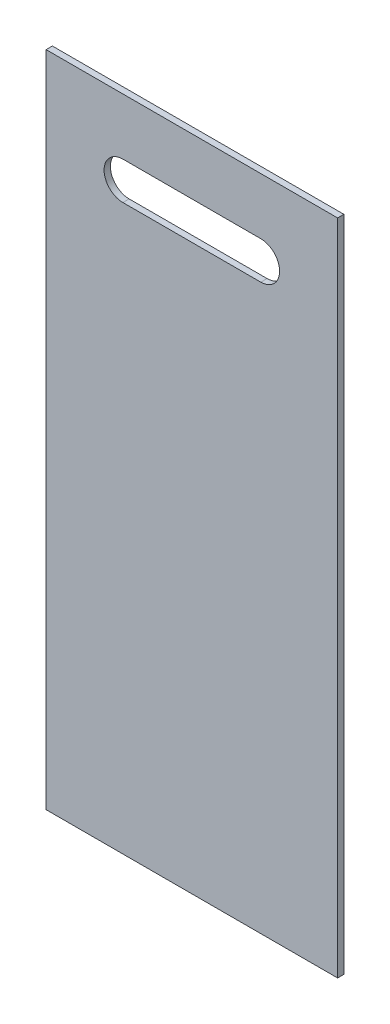
from build123d import *

# Parameters (mm, degrees)
SKETCH_1_W      = 232.5
SKETCH_1_H      = 525
EXTRUDE_1_DEPTH = 5


with BuildPart() as part:
    # 草图1 → 凸台-拉伸1 (new body)
    with BuildSketch(Plane.XY):
        Rectangle(SKETCH_1_W, SKETCH_1_H)
        with BuildLine():
            Line((-55, 217.5), (55, 217.5))
            ThreePointArc((55, 217.5), (70, 202.5), (55, 187.5))
            Line((55, 187.5), (-55, 187.5))
            ThreePointArc((-55, 187.5), (-70, 202.5), (-55, 217.5))
        make_face(mode=Mode.SUBTRACT)
    extrude(amount=EXTRUDE_1_DEPTH)


solid = part.part
